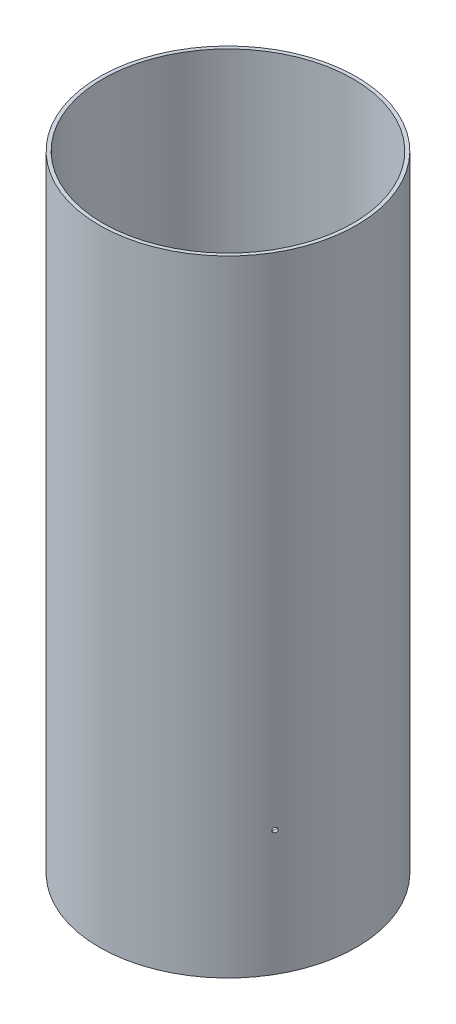
from build123d import *

# Parameters (mm, degrees)
SKETCH1_R               = 78.359
SKETCH1_R_2             = 76.2
BOSS_EXTRUDE1_DEPTH     = 381
CUT_EXTRUDE1_REACH      = 398.789
CUT_EXTRUDE1_END_RADIUS = 78.359
SKETCH2_R               = 1.41224
CIRPATTERN1_COUNT       = 3


with BuildPart() as part:
    # Sketch1 → Boss-Extrude1 (new body)
    with BuildSketch(Plane(origin=(0, 0, 0), x_dir=(1, 0, 0), z_dir=(0, 1, 0))):
        with Locations(Location((0, 0, 0), (0, 0, 270))):
            Circle(SKETCH1_R)
        with Locations(Location((0, 0, 0), (0, 0, 270))):
            Circle(SKETCH1_R_2, mode=Mode.SUBTRACT)
    extrude(amount=BOSS_EXTRUDE1_DEPTH)

    # Cut-Extrude1: up to this cylinder (the profile starts inside it)
    cut_extrude1_end = Plane(origin=(0, 76.2, 0), z_dir=(0, -1, 0)) * Cylinder(CUT_EXTRUDE1_END_RADIUS, 955.296, mode=Mode.PRIVATE)
    # Sketch2 → Cut-Extrude1 (cut, up to the surface)
    with BuildSketch(Plane.XY, mode=Mode.PRIVATE) as cut_extrude1_sk1:
        with Locations((0, 76.2)):
            Circle(SKETCH2_R)
    cut_extrude1_tool1 = extrude(cut_extrude1_sk1.sketch, amount=-CUT_EXTRUDE1_REACH, mode=Mode.PRIVATE) & cut_extrude1_end
    cut_extrude1 = cut_extrude1_tool1.solids().sort_by_distance((0, 76.2, 0))[0]
    add(cut_extrude1, mode=Mode.SUBTRACT)

    # CirPattern1: Cut-Extrude1 ×3 about axis
    cirpattern1_axis = Axis((0, 0, 0), (0, 1, 0))
    for i in range(1, CIRPATTERN1_COUNT):
        add(cut_extrude1.rotate(cirpattern1_axis, i * 360 / CIRPATTERN1_COUNT), mode=Mode.SUBTRACT)


solid = part.part
